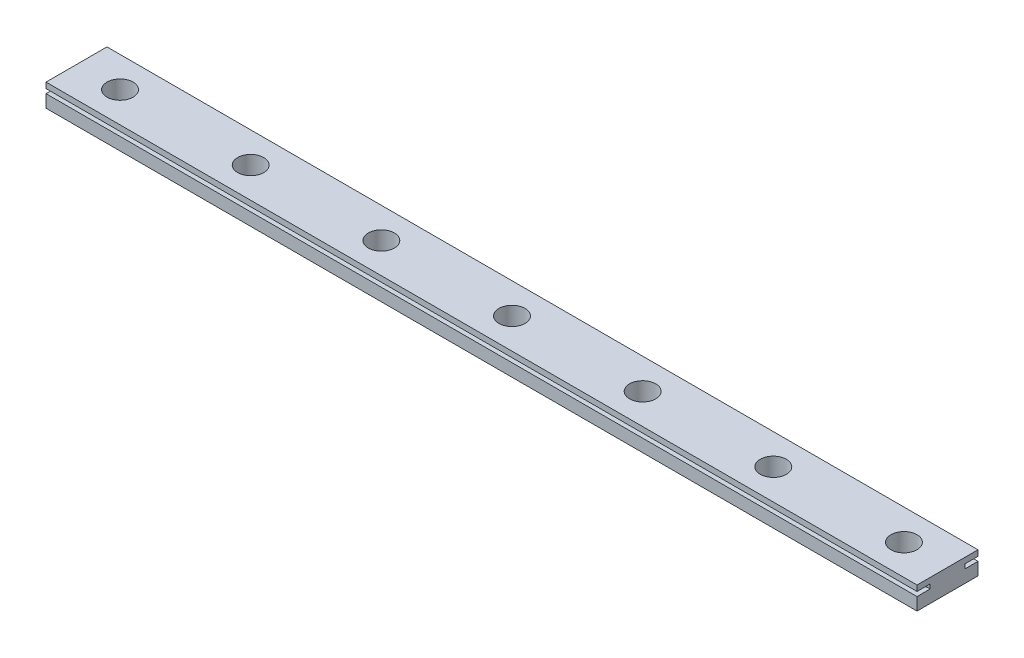
from build123d import *

# Parameters (mm, degrees)
SKETCH_1_W             = 200
SKETCH_1_H             = 14
EXTRUDE_1_DEPTH        = 5.2
SKETCH_2_W             = 3
SKETCH_2_H             = 1
CUT_EXTRUDE_1_DEPTH    = 210
SKETCH_3_R             = 1.75
CUT_EXTRUDE_2_DEPTH    = 31
SKETCH_3_3_R           = 3
CUT_EXTRUDE_3_DEPTH    = 4.5
PATTERN_LINEAR_1_COUNT = 7
PATTERN_LINEAR_1_PITCH = 30


with BuildPart() as part:
    # 草图1 → 凸台-拉伸1 (new body)
    with BuildSketch(Plane(origin=(0, 0, 0), x_dir=(1, 0, 0), z_dir=(0, 1, 0))):
        with Locations((100, 7)):
            Rectangle(SKETCH_1_W, SKETCH_1_H)
    extrude(amount=EXTRUDE_1_DEPTH)

    # 草图2 → 切除-拉伸1 (cut)
    with BuildSketch(Plane.ZY):
        with Locations((-12.5, 3.4)):
            Rectangle(SKETCH_2_W, SKETCH_2_H)
        with Locations((-1.5, 3.4)):
            Rectangle(SKETCH_2_W, SKETCH_2_H)
    extrude(amount=-CUT_EXTRUDE_1_DEPTH, mode=Mode.SUBTRACT)

    # 草图3 → 切除-拉伸2 (cut)
    with BuildSketch(Plane(origin=(0, 5.2, 0), x_dir=(1, 0, 0), z_dir=(0, 1, 0))):
        with Locations(Location((10, 7, 0), (0, 0, 270))):
            Circle(SKETCH_3_R)
    cut_extrude_2 = extrude(amount=-CUT_EXTRUDE_2_DEPTH, mode=Mode.SUBTRACT)

    # 草图3<3> → 切除-拉伸3 (cut)
    with BuildSketch(Plane(origin=(0, 5.2, 0), x_dir=(1, 0, 0), z_dir=(0, 1, 0))):
        with BuildLine():
            ThreePointArc((8.25, 7), (10, 5.25), (11.75, 7))
            Line((11.75, 7), (8.25, 7))
        make_face()
        with BuildLine():
            Line((8.25, 7), (11.75, 7))
            ThreePointArc((11.75, 7), (10, 8.75), (8.25, 7))
        make_face()
        with Locations(Location((10, 7, 0), (0, 0, 270))):
            Circle(SKETCH_3_3_R)
    cut_extrude_3 = extrude(amount=-CUT_EXTRUDE_3_DEPTH, mode=Mode.SUBTRACT)

    # 阵列(线性)1: 切除-拉伸2, 切除-拉伸3 ×7
    with Locations(*[(i * PATTERN_LINEAR_1_PITCH, 0, 0) for i in range(1, PATTERN_LINEAR_1_COUNT)]):
        add(cut_extrude_2, mode=Mode.SUBTRACT)
        add(cut_extrude_3, mode=Mode.SUBTRACT)


solid = part.part
